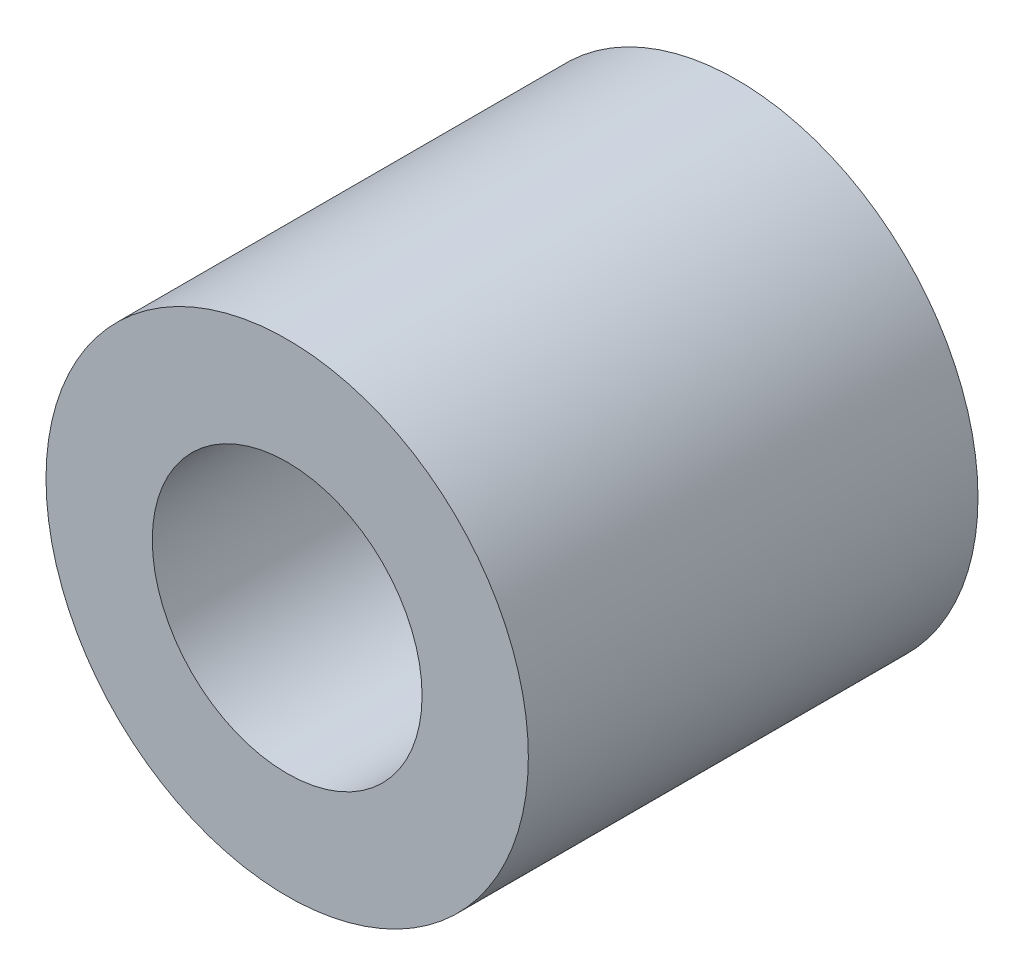
from build123d import *

# Parameters (mm, degrees)
SKETCH1_R           = 2.95
SKETCH1_R_2         = 1.65
BOSS_EXTRUDE1_DEPTH = 5.5


with BuildPart() as part:
    # Sketch1 → Boss-Extrude1 (new body)
    with BuildSketch(Plane.XY):
        Circle(SKETCH1_R)
        Circle(SKETCH1_R_2, mode=Mode.SUBTRACT)
    extrude(amount=BOSS_EXTRUDE1_DEPTH)


solid = part.part
